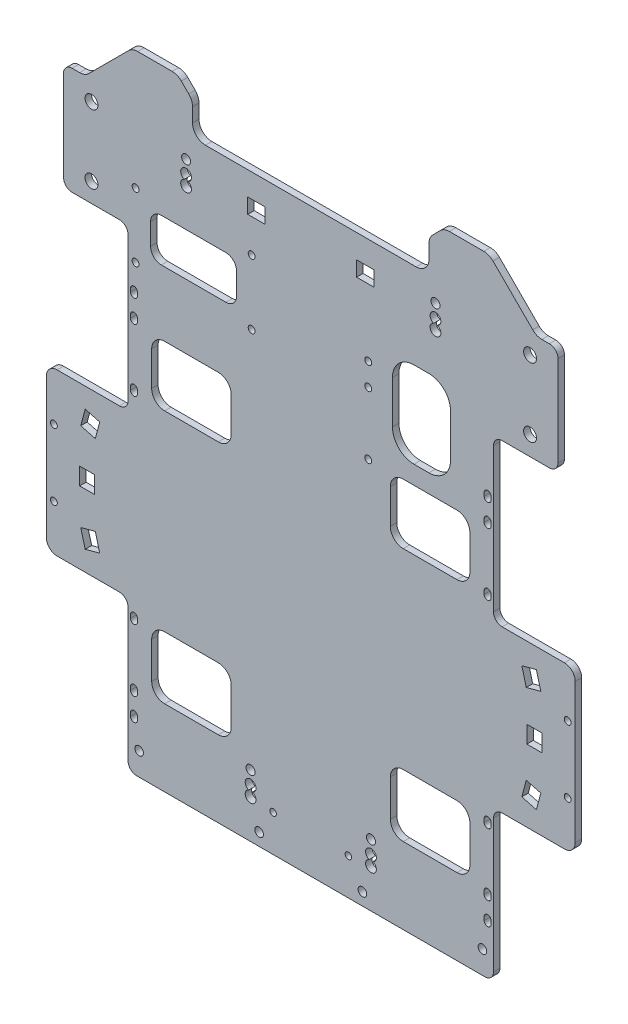
from build123d import *

# Parameters (mm, degrees)
SKETCH_1_R           = 1.6
SKETCH_1_W           = 27
SKETCH_1_H           = 40
EXTRUDE_1_DEPTH      = 3
CUT_EXTRUDE_1_DEPTH  = 10
FILLET_1_R           = 4
SKETCH_4_W           = 7
SKETCH_4_H           = 8
CUT_EXTRUDE_2_DEPTH  = 272.149470678
SKETCH_5_R           = 3
CUT_EXTRUDE_3_DEPTH  = 272.149470678
SKETCH_6_R           = 1.6
CUT_EXTRUDE_4_DEPTH  = 272.149470678
SKETCH_9_R           = 2
CUT_EXTRUDE_6_DEPTH  = 10
SKETCH_10_R          = 1.5
SKETCH_10_W          = 8
SKETCH_10_H          = 7
CUT_EXTRUDE_7_DEPTH  = 10
FILLET_2_R           = 10
FILLET_3_R           = 4
CUT_EXTRUDE_8_DEPTH  = 272.149470678
EXTRUDE_2_DEPTH      = 3
FILLET_4_R           = 6
EXTRUDE_START        = 3
EXTRUDE_3_DEPTH      = 3
SKETCH_16_R          = 1.6
CUT_EXTRUDE_10_DEPTH = 276.558240983
SKETCH_17_R          = 2.1
CUT_EXTRUDE_11_DEPTH = 276.558240983


with BuildPart() as part:
    # 草图1 → 凸台-拉伸1 (new body)
    with BuildSketch(Plane.XY):
        Polygon((-146.644295302, 41.946308725), (83.355704698, 41.946308725), (83.355704698, -8.053691275), (53.355704698, -8.053691275), (53.355704698, -83.053691275), (83.355704698, -83.053691275), (83.355704698, -158.053691275), (53.355704698, -158.053691275), (53.355704698, -228.053691275), (-116.644295302, -228.053691275), (-116.644295302, -158.053691275), (-146.644295302, -158.053691275), (-146.644295302, -83.053691275), (-116.644295302, -83.053691275), (-116.644295302, -8.053691275), (-146.644295302, -8.053691275), align=None)
        with Locations((-4.894295302, -7.213691275)):
            Circle(SKETCH_1_R, mode=Mode.SUBTRACT)
        with Locations((-4.894295302, -17.713691275)):
            Circle(SKETCH_1_R, mode=Mode.SUBTRACT)
        with Locations((-4.894295302, -46.713691275)):
            Circle(SKETCH_1_R, mode=Mode.SUBTRACT)
        with Locations((19.855704698, -18.053691275)):
            Rectangle(SKETCH_1_W, SKETCH_1_H, mode=Mode.SUBTRACT)
    extrude(amount=EXTRUDE_1_DEPTH)

    # 草图3 → 切除-拉伸1 (cut)
    with BuildSketch(Plane.XY.offset(3)):
        with BuildLine():
            Line((49.005704698, -72.553691275), (49.005704698, -74.153691275))
            ThreePointArc((49.005704698, -74.153691275), (50.605704698, -75.753691275), (52.205704698, -74.153691275))
            Line((52.205704698, -74.153691275), (52.205704698, -72.553691275))
            ThreePointArc((52.205704698, -72.553691275), (50.605704698, -70.953691275), (49.005704698, -72.553691275))
        make_face()
        with BuildLine():
            Line((49.005704698, -43.553691275), (49.005704698, -45.153691275))
            ThreePointArc((49.005704698, -45.153691275), (50.605704698, -46.753691275), (52.205704698, -45.153691275))
            Line((52.205704698, -45.153691275), (52.205704698, -43.553691275))
            ThreePointArc((52.205704698, -43.553691275), (50.605704698, -41.953691275), (49.005704698, -43.553691275))
        make_face()
        with BuildLine():
            Line((49.005704698, -33.053691275), (49.005704698, -34.653691275))
            ThreePointArc((49.005704698, -34.653691275), (50.605704698, -36.253691275), (52.205704698, -34.653691275))
            Line((52.205704698, -34.653691275), (52.205704698, -33.053691275))
            ThreePointArc((52.205704698, -33.053691275), (50.605704698, -31.453691275), (49.005704698, -33.053691275))
        make_face()
        with BuildLine():
            Line((49.005704698, -164.453691275), (49.005704698, -166.053691275))
            ThreePointArc((49.005704698, -166.053691275), (50.605704698, -167.653691275), (52.205704698, -166.053691275))
            Line((52.205704698, -166.053691275), (52.205704698, -164.453691275))
            ThreePointArc((52.205704698, -164.453691275), (50.605704698, -162.853691275), (49.005704698, -164.453691275))
        make_face()
        with BuildLine():
            Line((49.005704698, -193.453691275), (49.005704698, -195.053691275))
            ThreePointArc((49.005704698, -195.053691275), (50.605704698, -196.653691275), (52.205704698, -195.053691275))
            Line((52.205704698, -195.053691275), (52.205704698, -193.453691275))
            ThreePointArc((52.205704698, -193.453691275), (50.605704698, -191.853691275), (49.005704698, -193.453691275))
        make_face()
        with BuildLine():
            Line((49.005704698, -203.953691275), (49.005704698, -205.553691275))
            ThreePointArc((49.005704698, -205.553691275), (50.605704698, -207.153691275), (52.205704698, -205.553691275))
            Line((52.205704698, -205.553691275), (52.205704698, -203.953691275))
            ThreePointArc((52.205704698, -203.953691275), (50.605704698, -202.353691275), (49.005704698, -203.953691275))
        make_face()
        with BuildLine():
            Line((-115.494295302, -33.053691275), (-115.494295302, -34.653691275))
            ThreePointArc((-115.494295302, -34.653691275), (-113.894295302, -36.253691275), (-112.294295302, -34.653691275))
            Line((-112.294295302, -34.653691275), (-112.294295302, -33.053691275))
            ThreePointArc((-112.294295302, -33.053691275), (-113.894295302, -31.453691275), (-115.494295302, -33.053691275))
        make_face()
        with BuildLine():
            Line((-115.494295302, -43.553691275), (-115.494295302, -45.153691275))
            ThreePointArc((-115.494295302, -45.153691275), (-113.894295302, -46.753691275), (-112.294295302, -45.153691275))
            Line((-112.294295302, -45.153691275), (-112.294295302, -43.553691275))
            ThreePointArc((-112.294295302, -43.553691275), (-113.894295302, -41.953691275), (-115.494295302, -43.553691275))
        make_face()
        with BuildLine():
            Line((-115.494295302, -72.553691275), (-115.494295302, -74.153691275))
            ThreePointArc((-115.494295302, -74.153691275), (-113.894295302, -75.753691275), (-112.294295302, -74.153691275))
            Line((-112.294295302, -74.153691275), (-112.294295302, -72.553691275))
            ThreePointArc((-112.294295302, -72.553691275), (-113.894295302, -70.953691275), (-115.494295302, -72.553691275))
        make_face()
        with BuildLine():
            Line((-115.494295302, -164.453691275), (-115.494295302, -166.053691275))
            ThreePointArc((-115.494295302, -166.053691275), (-113.894295302, -167.653691275), (-112.294295302, -166.053691275))
            Line((-112.294295302, -166.053691275), (-112.294295302, -164.453691275))
            ThreePointArc((-112.294295302, -164.453691275), (-113.894295302, -162.853691275), (-115.494295302, -164.453691275))
        make_face()
        with BuildLine():
            Line((-115.494295302, -193.453691275), (-115.494295302, -195.053691275))
            ThreePointArc((-115.494295302, -195.053691275), (-113.894295302, -196.653691275), (-112.294295302, -195.053691275))
            Line((-112.294295302, -195.053691275), (-112.294295302, -193.453691275))
            ThreePointArc((-112.294295302, -193.453691275), (-113.894295302, -191.853691275), (-115.494295302, -193.453691275))
        make_face()
        with BuildLine():
            Line((-115.494295302, -203.953691275), (-115.494295302, -205.553691275))
            ThreePointArc((-115.494295302, -205.553691275), (-113.894295302, -207.153691275), (-112.294295302, -205.553691275))
            Line((-112.294295302, -205.553691275), (-112.294295302, -203.953691275))
            ThreePointArc((-112.294295302, -203.953691275), (-113.894295302, -202.353691275), (-115.494295302, -203.953691275))
        make_face()
    extrude(amount=-CUT_EXTRUDE_1_DEPTH, mode=Mode.SUBTRACT)

    # 圆角1
    fillet_1_edges = [part.edges().sort_by_distance(p)[0] for p in [
        (-146.644295302, 41.946308725, 1.5),
        (83.355704698, 41.946308725, 1.5),
        (83.355704698, -8.053691275, 1.5),
        (83.355704698, -83.053691275, 1.5),
        (83.355704698, -158.053691275, 1.5),
        (53.355704698, -228.053691275, 1.5),
        (-116.644295302, -228.053691275, 1.5),
        (-146.644295302, -158.053691275, 1.5),
        (-146.644295302, -83.053691275, 1.5),
        (-146.644295302, -8.053691275, 1.5),
    ]]
    fillet(fillet_1_edges, radius=FILLET_1_R)

    # 草图4 → 切除-拉伸2 (cut, through all)
    with BuildSketch(Plane.XY.offset(3)):
        with Locations((72.355704698, -120.553691275)):
            Rectangle(SKETCH_4_W, SKETCH_4_H)
        Polygon((75.355704698, -100.053691275), (73.285152337, -92.326284665), (66.523671553, -94.138017981), (68.594223914, -101.865424591), align=None)
        Polygon((66.523671553, -146.96936457), (68.594223914, -139.241957959), (75.355704698, -141.053691275), (73.285152337, -148.781097885), align=None)
        Polygon((-129.812262157, -94.138017981), (-131.882814518, -101.865424591), (-138.644295302, -100.053691275), (-136.573742941, -92.326284665), align=None)
        with Locations((-135.644295302, -120.553691275)):
            Rectangle(SKETCH_4_W, SKETCH_4_H)
        Polygon((-136.573742941, -148.781097885), (-129.812262157, -146.96936457), (-131.882814518, -139.241957959), (-138.644295302, -141.053691275), align=None)
    extrude(amount=-CUT_EXTRUDE_2_DEPTH, mode=Mode.SUBTRACT)

    # 草图5 → 切除-拉伸3 (cut, through all)
    with BuildSketch(Plane.XY.offset(3)):
        with Locations((70.355704698, 32.946308725)):
            Circle(SKETCH_5_R)
        with Locations((70.355704698, 0.946308725)):
            Circle(SKETCH_5_R)
        with Locations(Location((-133.644295302, 0.946308725, 0), (0, 0, 180))):
            Circle(SKETCH_5_R)
        with Locations(Location((-133.644295302, 32.946308725, 0), (0, 0, 180))):
            Circle(SKETCH_5_R)
    extrude(amount=-CUT_EXTRUDE_3_DEPTH, mode=Mode.SUBTRACT)

    # 草图6 → 切除-拉伸4 (cut, through all)
    with BuildSketch(Plane.XY.offset(3)):
        with Locations((-113.144295302, -21.553691275)):
            Circle(SKETCH_6_R)
        with Locations((-59.144295302, -21.553691275)):
            Circle(SKETCH_6_R)
        with Locations((-113.144295302, 8.446308725)):
            Circle(SKETCH_6_R)
        with Locations((-59.144295302, 8.446308725)):
            Circle(SKETCH_6_R)
        with BuildLine():
            Line((-106.144295302, -1.553691275), (-106.144295302, -11.553691275))
            ThreePointArc((-106.144295302, -11.553691275), (-104.679829208, -15.089225181), (-101.144295302, -16.553691275))
            Line((-101.144295302, -16.553691275), (-71.144295302, -16.553691275))
            ThreePointArc((-71.144295302, -16.553691275), (-67.608761396, -15.089225181), (-66.144295302, -11.553691275))
            Line((-66.144295302, -11.553691275), (-66.144295302, -1.553691275))
            ThreePointArc((-66.144295302, -1.553691275), (-67.608761396, 1.981842631), (-71.144295302, 3.446308725))
            Line((-71.144295302, 3.446308725), (-101.144295302, 3.446308725))
            ThreePointArc((-101.144295302, 3.446308725), (-104.679829208, 1.981842631), (-106.144295302, -1.553691275))
        make_face()
    extrude(amount=-CUT_EXTRUDE_4_DEPTH, mode=Mode.SUBTRACT)

    # 草图9 → 切除-拉伸6 (cut)
    with BuildSketch(Plane.XY.offset(3)):
        with Locations((48.196680967, -217.4027845)):
            Circle(SKETCH_9_R)
        with Locations((-7.616162024, -222.261873378)):
            Circle(SKETCH_9_R)
        with Locations((-55.67242858, -222.261873378)):
            Circle(SKETCH_9_R)
        with Locations((-111.485271571, -217.4027845)):
            Circle(SKETCH_9_R)
    extrude(amount=-CUT_EXTRUDE_6_DEPTH, mode=Mode.SUBTRACT)

    # 草图10 → 切除-拉伸7 (cut)
    with BuildSketch(Plane.XY.offset(3)):
        with Locations((-14.144295302, -211.053691275)):
            Circle(SKETCH_10_R)
        with Locations((-49.144295302, -211.053691275)):
            Circle(SKETCH_10_R)
        with Locations((-6.320086284, 27.446314454)):
            Rectangle(SKETCH_10_W, SKETCH_10_H)
        with Locations((-56.96850432, 27.446314454)):
            Rectangle(SKETCH_10_W, SKETCH_10_H)
    extrude(amount=-CUT_EXTRUDE_7_DEPTH, mode=Mode.SUBTRACT)

    # 圆角2
    fillet_2_edges = [part.edges().sort_by_distance(p)[0] for p in [
        (6.355704698, 1.946308725, 1.5),
        (6.355704698, -38.053691275, 1.5),
        (33.355704698, -38.053691275, 1.5),
        (33.355704698, 1.946308725, 1.5),
    ]]
    fillet(fillet_2_edges, radius=FILLET_2_R)

    # 圆角3
    fillet_3_edges = [part.edges().sort_by_distance(p)[0] for p in [
        (53.355704698, -8.053691275, 1.5),
        (53.355704698, -83.053691275, 1.5),
        (53.355704698, -158.053691275, 1.5),
        (-116.644295302, -158.053691275, 1.5),
        (-116.644295302, -83.053691275, 1.5),
        (-116.644295302, -8.053691275, 1.5),
    ]]
    fillet(fillet_3_edges, radius=FILLET_3_R)

    # 草图12 → 切除-拉伸8 (cut, through all)
    with BuildSketch(Plane.XY.offset(3)):
        with BuildLine():
            Line((-105.644295302, -52.553691275), (-105.644295302, -68.553691275))
            ThreePointArc((-105.644295302, -68.553691275), (-103.886935989, -72.796331962), (-99.644295302, -74.553691275))
            Line((-99.644295302, -74.553691275), (-74.644295302, -74.553691275))
            ThreePointArc((-74.644295302, -74.553691275), (-70.401654615, -72.796331962), (-68.644295302, -68.553691275))
            Line((-68.644295302, -68.553691275), (-68.644295302, -52.553691275))
            ThreePointArc((-68.644295302, -52.553691275), (-70.401654615, -48.311050588), (-74.644295302, -46.553691275))
            Line((-74.644295302, -46.553691275), (-99.644295302, -46.553691275))
            ThreePointArc((-99.644295302, -46.553691275), (-103.886935989, -48.311050588), (-105.644295302, -52.553691275))
        make_face()
        with BuildLine():
            Line((-105.644295302, -169.553691275), (-105.644295302, -186.553691275))
            ThreePointArc((-105.644295302, -186.553691275), (-103.886935989, -190.796331962), (-99.644295302, -192.553691275))
            Line((-99.644295302, -192.553691275), (-74.644295302, -192.553691275))
            ThreePointArc((-74.644295302, -192.553691275), (-70.401654615, -190.796331962), (-68.644295302, -186.553691275))
            Line((-68.644295302, -186.553691275), (-68.644295302, -169.553691275))
            ThreePointArc((-68.644295302, -169.553691275), (-70.401654615, -165.311050588), (-74.644295302, -163.553691275))
            Line((-74.644295302, -163.553691275), (-99.644295302, -163.553691275))
            ThreePointArc((-99.644295302, -163.553691275), (-103.886935989, -165.311050588), (-105.644295302, -169.553691275))
        make_face()
        with BuildLine():
            Line((5.355704698, -186.553691275), (5.355704698, -169.553691275))
            ThreePointArc((5.355704698, -169.553691275), (7.113064011, -165.311050588), (11.355704698, -163.553691275))
            Line((11.355704698, -163.553691275), (36.355704698, -163.553691275))
            ThreePointArc((36.355704698, -163.553691275), (40.598345385, -165.311050588), (42.355704698, -169.553691275))
            Line((42.355704698, -169.553691275), (42.355704698, -186.553691275))
            ThreePointArc((42.355704698, -186.553691275), (40.598345385, -190.796331962), (36.355704698, -192.553691275))
            Line((36.355704698, -192.553691275), (11.355704698, -192.553691275))
            ThreePointArc((11.355704698, -192.553691275), (7.113064011, -190.796331962), (5.355704698, -186.553691275))
        make_face()
        with BuildLine():
            Line((5.355704698, -68.553691275), (5.355704698, -52.553691275))
            ThreePointArc((5.355704698, -52.553691275), (7.113064011, -48.311050588), (11.355704698, -46.553691275))
            Line((11.355704698, -46.553691275), (36.355704698, -46.553691275))
            ThreePointArc((36.355704698, -46.553691275), (40.598345385, -48.311050588), (42.355704698, -52.553691275))
            Line((42.355704698, -52.553691275), (42.355704698, -68.553691275))
            ThreePointArc((42.355704698, -68.553691275), (40.598345385, -72.796331962), (36.355704698, -74.553691275))
            Line((36.355704698, -74.553691275), (11.355704698, -74.553691275))
            ThreePointArc((11.355704698, -74.553691275), (7.113064011, -72.796331962), (5.355704698, -68.553691275))
        make_face()
    extrude(amount=-CUT_EXTRUDE_8_DEPTH, mode=Mode.SUBTRACT)

    # 草图13 → 凸台-拉伸2 (add)
    with BuildSketch(Plane.XY):
        Polygon((51.355704698, 63.946308725), (30.355704698, 63.946308725), (23.355704698, 56.946308725), (23.355704698, 41.946308725), (73.355704698, 41.946308725), align=None)
        Polygon((-93.644295302, 63.946308725), (-86.644295302, 56.946308725), (-86.644295302, 41.946308725), (-136.644295302, 41.946308725), (-114.644295302, 63.946308725), align=None)
    extrude(amount=EXTRUDE_2_DEPTH)

    # 圆角4
    fillet_4_edges = [part.edges().sort_by_distance(p)[0] for p in [
        (23.355704698, 41.946308725, 1.5),
        (73.355704698, 41.946308725, 1.5),
        (51.355704698, 63.946308725, 1.5),
        (30.355704698, 63.946308725, 1.5),
        (23.355704698, 56.946308725, 1.5),
        (-93.644295302, 63.946308725, 1.5),
        (-114.644295302, 63.946308725, 1.5),
        (-136.644295302, 41.946308725, 1.5),
        (-86.644295302, 41.946308725, 1.5),
        (-86.644295302, 56.946308725, 1.5),
    ]]
    fillet(fillet_4_edges, radius=FILLET_4_R)

    # 草图14 → 凸台-拉伸3 (add)
    with BuildSketch(Plane.XY.offset(EXTRUDE_START)):
        with BuildLine():
            Line((-142.644295302, -83.053691275), (-149.644295302, -83.053691275))
            ThreePointArc((-149.644295302, -83.053691275), (-153.179829208, -84.518157369), (-154.644295302, -88.053691275))
            Line((-154.644295302, -88.053691275), (-154.644295302, -153.053691275))
            ThreePointArc((-154.644295302, -153.053691275), (-153.179829208, -156.589225181), (-149.644295302, -158.053691275))
            Line((-149.644295302, -158.053691275), (-142.644295302, -158.053691275))
            ThreePointArc((-142.644295302, -158.053691275), (-145.472722427, -156.8821184), (-146.644295302, -154.053691275))
            Line((-146.644295302, -154.053691275), (-146.644295302, -87.053691275))
            ThreePointArc((-146.644295302, -87.053691275), (-145.472722427, -84.22526415), (-142.644295302, -83.053691275))
        make_face()
        with BuildLine():
            Line((83.355704698, -87.053691275), (83.355704698, -154.053691275))
            ThreePointArc((83.355704698, -154.053691275), (82.184131823, -156.8821184), (79.355704698, -158.053691275))
            Line((79.355704698, -158.053691275), (86.355704698, -158.053691275))
            ThreePointArc((86.355704698, -158.053691275), (89.891238604, -156.589225181), (91.355704698, -153.053691275))
            Line((91.355704698, -153.053691275), (91.355704698, -88.053691275))
            ThreePointArc((91.355704698, -88.053691275), (89.891238604, -84.518157369), (86.355704698, -83.053691275))
            Line((86.355704698, -83.053691275), (79.355704698, -83.053691275))
            ThreePointArc((79.355704698, -83.053691275), (82.184131823, -84.22526415), (83.355704698, -87.053691275))
        make_face()
    extrude(amount=-EXTRUDE_3_DEPTH)

    # 草图16 → 切除-拉伸10 (cut, through all)
    with BuildSketch(Plane.XY):
        with Locations((87.855704698, -105.713691275)):
            Circle(SKETCH_16_R)
        with Locations((87.855704698, -136.743691275)):
            Circle(SKETCH_16_R)
        with Locations(Location((-151.144295302, -105.713691275, 0), (0, 0, 180))):
            Circle(SKETCH_16_R)
        with Locations(Location((-151.144295302, -136.743691275, 0), (0, 0, 180))):
            Circle(SKETCH_16_R)
    extrude(amount=CUT_EXTRUDE_10_DEPTH, mode=Mode.SUBTRACT)

    # 草图17 → 切除-拉伸11 (cut, through all)
    with BuildSketch(Plane.XY.offset(3)):
        with Locations((-89.644295302, 31.796308725)):
            Circle(SKETCH_17_R)
        with Locations((-59.644295302, -199.203691275)):
            Circle(SKETCH_17_R)
        with Locations(Location((-3.644295302, -199.203691275, 0), (0, 0, 180))):
            Circle(SKETCH_17_R)
        with Locations(Location((26.355704698, 31.796308725, 0), (0, 0, 180))):
            Circle(SKETCH_17_R)
        with BuildLine():
            ThreePointArc((-88.791359197, 23.296308725), (-89.644295302, 28.146308725), (-90.497231407, 23.296308725))
            ThreePointArc((-90.497231407, 23.296308725), (-89.644295302, 18.446308725), (-88.791359197, 23.296308725))
        make_face()
        with BuildLine():
            ThreePointArc((-58.791359197, -207.703691275), (-59.644295302, -202.853691275), (-60.497231407, -207.703691275))
            ThreePointArc((-60.497231407, -207.703691275), (-59.644295302, -212.553691275), (-58.791359197, -207.703691275))
        make_face()
        with BuildLine():
            ThreePointArc((-2.791359197, -207.703691275), (-3.644295302, -212.553691275), (-4.497231407, -207.703691275))
            ThreePointArc((-4.497231407, -207.703691275), (-3.644295302, -202.853691275), (-2.791359197, -207.703691275))
        make_face()
        with BuildLine():
            ThreePointArc((27.208640803, 23.296308725), (26.355704698, 18.446308725), (25.502768593, 23.296308725))
            ThreePointArc((25.502768593, 23.296308725), (26.355704698, 28.146308725), (27.208640803, 23.296308725))
        make_face()
    extrude(amount=-CUT_EXTRUDE_11_DEPTH, mode=Mode.SUBTRACT)


solid = part.part
